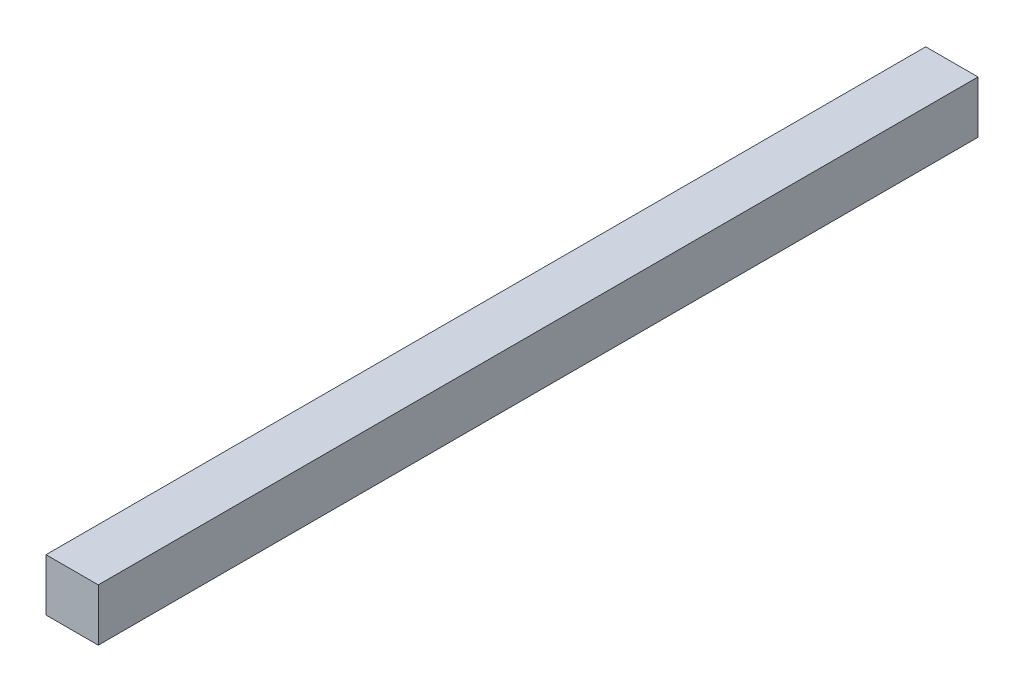
from build123d import *

# Parameters (mm, degrees)
SKETCH1_W           = 12
SKETCH1_H           = 12
BOSS_EXTRUDE1_DEPTH = 202


with BuildPart() as part:
    # Sketch1 → Boss-Extrude1 (new body)
    with BuildSketch(Plane.XY):
        Rectangle(SKETCH1_W, SKETCH1_H)
    extrude(amount=BOSS_EXTRUDE1_DEPTH)


solid = part.part
